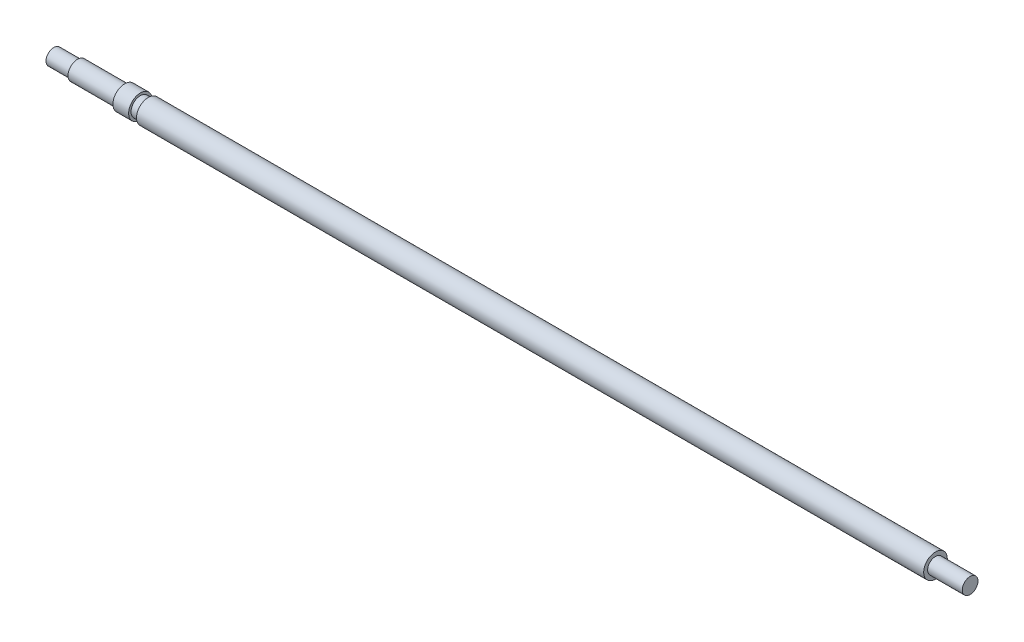
from build123d import *


with BuildPart() as part:
    # 草图2 → 旋转1 (revolve)
    with BuildSketch(Plane.XY, mode=Mode.PRIVATE) as revolve_1_sk:
        Polygon((3983.119860872, 589.332150707), (3998.119860872, 589.332150707), (3998.119860872, 590.332150707), (4028.119860872, 590.332150707), (4028.119860872, 591.832150707), (4038.119860872, 591.832150707), (4038.119860872, 590.332150707), (4043.119860872, 590.332150707), (4043.119860872, 591.832150707), (4543.119860872, 591.832150707), (4543.119860872, 589.332150707), (4565.119860872, 589.332150707), (4565.119860872, 584.332150707), (3983.119860872, 584.332150707), align=None)
    revolve(revolve_1_sk.sketch.rotate(Axis((4565.119860872, 584.332150707, 0), (-1, 0, 0)), 90), axis=Axis((4565.119860872, 584.332150707, 0), (-1, 0, 0)))


solid = part.part
